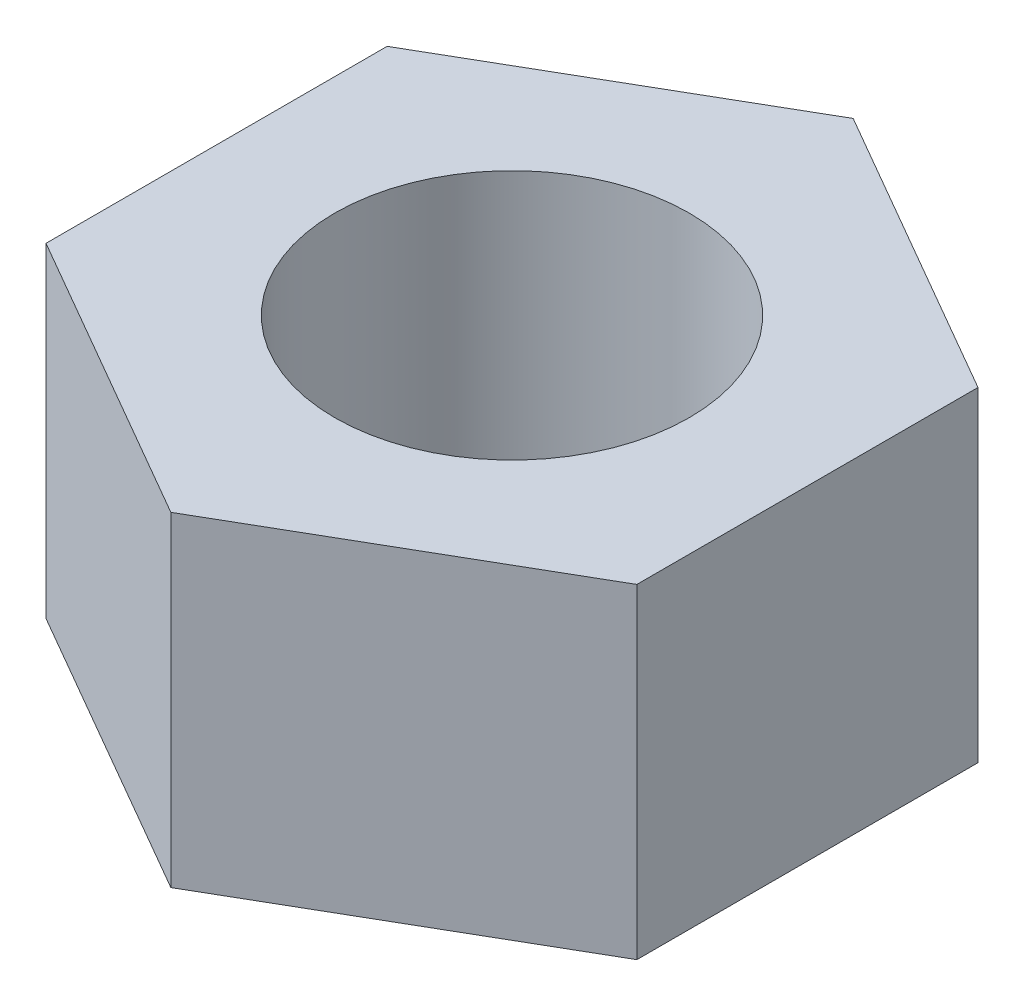
from build123d import *

# Parameters (mm, degrees)
SKETCH_1_R      = 3
EXTRUDE_1_DEPTH = 5.5


with BuildPart() as part:
    # Эскиз1 → Вытянуть1 (new body)
    with BuildSketch(Plane(origin=(0, 0, 0), x_dir=(1, 0, 0), z_dir=(0, 1, 0))):
        Polygon((0, -5.773502692), (5, -2.886751346), (5, 2.886751346), (0, 5.773502692), (-5, 2.886751346), (-5, -2.886751346), align=None)
        with Locations(Location((0, 0, 0), (0, 0, 270))):
            Circle(SKETCH_1_R, mode=Mode.SUBTRACT)
    extrude(amount=EXTRUDE_1_DEPTH)


solid = part.part
